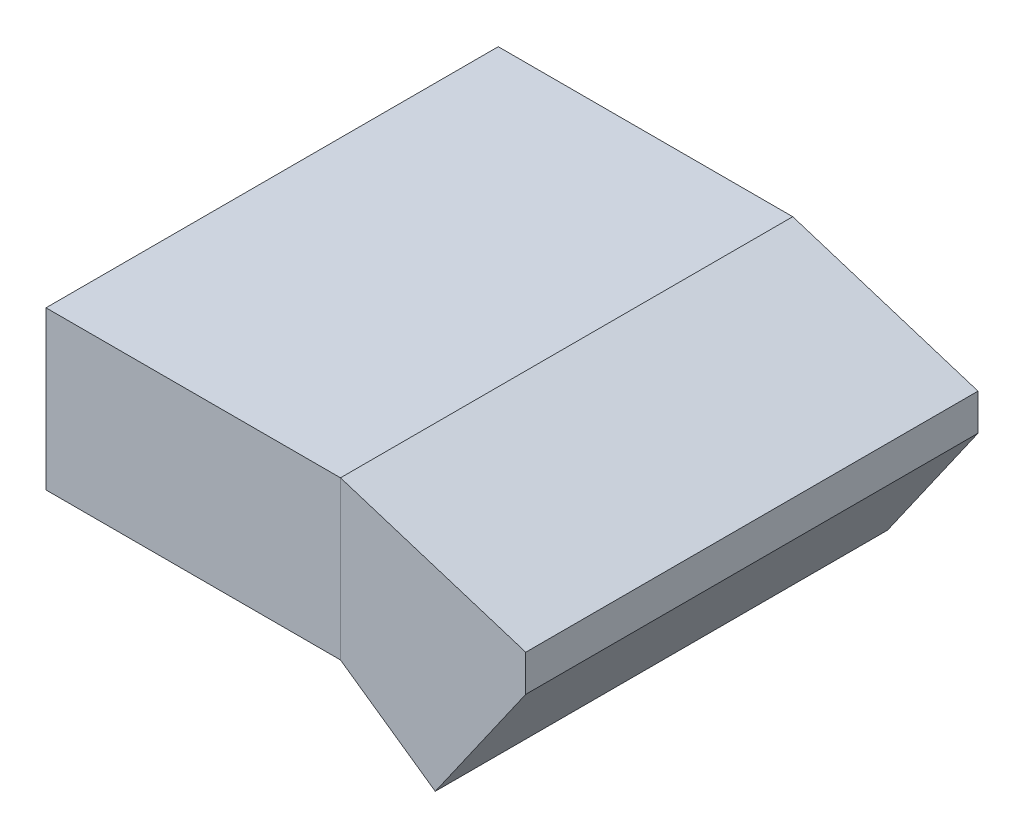
from build123d import *

# Parameters (mm, degrees)
HOUSING_DEPTH      = 3
KINK_HOUSING_DEPTH = 8.6


with BuildPart() as part:
    # Sketch1 → Housing (new body)
    with BuildSketch(Plane(origin=(0, 0, 0), x_dir=(1, 0, 0), z_dir=(0, 1, 0))):
        Polygon((3.9, 6.9), (-1.7, 6.9), (-1.7, -1.7), (3.9, -1.7), (3.9, 5.2), align=None)
    extrude(amount=HOUSING_DEPTH)


with BuildPart() as body_2:
    # Tilted Magnet → Kink Housing (new body)
    with BuildSketch(Plane(origin=(0, 0, -6.9), x_dir=(-1, 0, 0), z_dir=(0, 0, -1))):
        Polygon((-3.9, 3), (-7.422863806, 1.889245308), (-7.422863806, 1.195587973), (-5.702134497, -1.26186816), (-3.9, 0), align=None)
    extrude(amount=-KINK_HOUSING_DEPTH)


solid = Compound([part.part, body_2.part])
